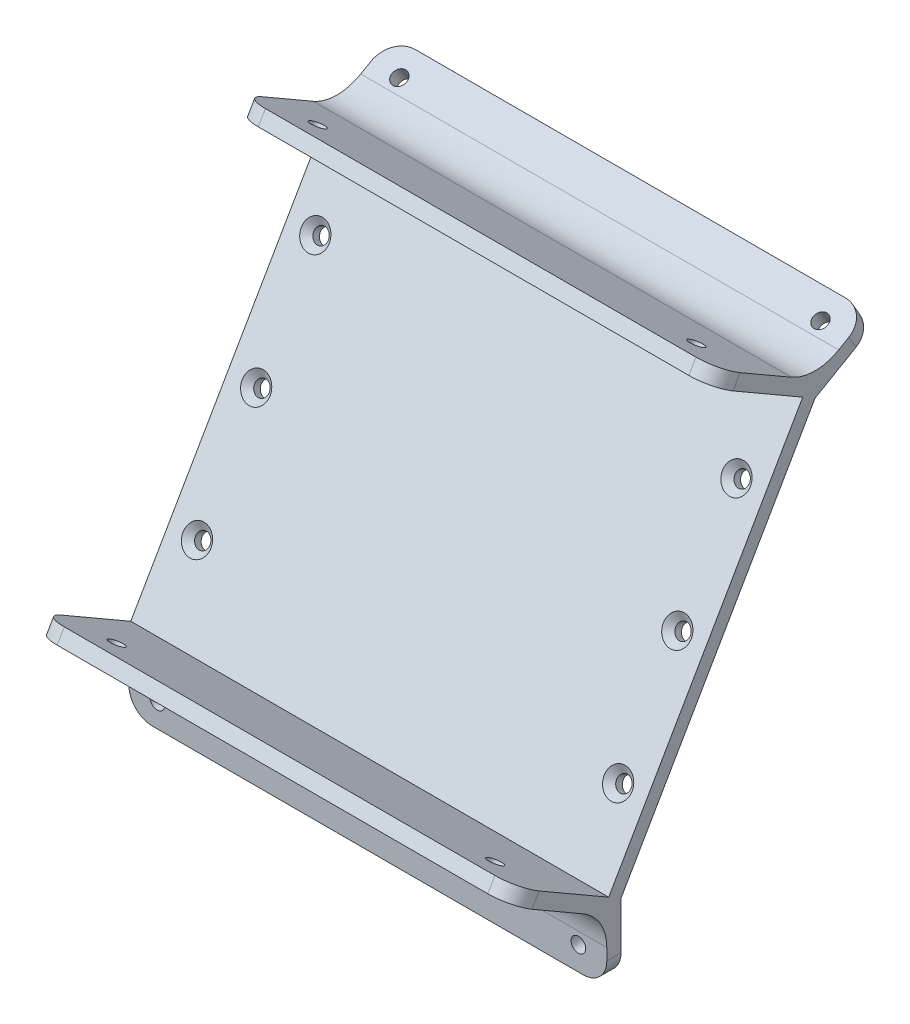
from build123d import *

# Parameters (mm, degrees)
SKETCH_1_W               = 101
SKETCH_1_H               = 15
SKETCH_1_R               = 1.55
EXTRUDE_1_DEPTH          = 3
EXTRUDE_2_DEPTH          = 101
FILLET_1_R               = 10
FILLET_2_R               = 5
SKETCH_3_W               = 101
SKETCH_3_H               = 3
EXTRUDE_3_DEPTH          = 41
SKETCH_4_R               = 1.55
CUT_EXTRUDE_1_DEPTH      = 153.872823645
CUT_EXTRUDE_2_DEPTH      = 149.186409795
CUT_EXTRUDE_2_DEPTH_BACK = 10
SKETCH_5_R               = 1.55
CHAMFER_1_SIZE           = 1.4


with BuildPart() as part:
    # 草图1 → 凸台-拉伸1 (new body)
    with BuildSketch(Plane.XY):
        with Locations((50.5, 7.5)):
            Rectangle(SKETCH_1_W, SKETCH_1_H)
        with Locations((6, 5)):
            Circle(SKETCH_1_R, mode=Mode.SUBTRACT)
        with Locations((95, 5)):
            Circle(SKETCH_1_R, mode=Mode.SUBTRACT)
    extrude(amount=EXTRUDE_1_DEPTH)

    # 草图2 → 凸台-拉伸2 (add)
    with BuildSketch(Plane.ZY):
        Polygon((0, 15), (21.650635095, 27.5), (23.150635095, 24.901923789), (3, 13.267949192), align=None)
    extrude(amount=-EXTRUDE_2_DEPTH)

    # 圆角1
    fillet_1_edges = [part.edges().sort_by_distance(p)[0] for p in [
        (50.5, 13.267949192, 3),
    ]]
    fillet(fillet_1_edges, radius=FILLET_1_R)

    # 圆角2
    fillet_2_edges = [part.edges().sort_by_distance(p)[0] for p in [
        (0, 26.200961894, 22.400635095),
        (101, 26.200961894, 22.400635095),
        (101, 0, 1.5),
        (0, 0, 1.5),
    ]]
    fillet(fillet_2_edges, radius=FILLET_2_R)

    # 草图3 → 凸台-拉伸3 (add)
    with BuildSketch(Plane(origin=(0, 11.25, -6.495190528), x_dir=(1, 0, 0), z_dir=(0, 0.8660254037844364, -0.5000000000000041))):
        with Locations((50.5, -9)):
            Rectangle(SKETCH_3_W, SKETCH_3_H)
    extrude(amount=EXTRUDE_3_DEPTH)

    # 镜向3: part across plane


with BuildPart() as part_1:
    add(part.part)
    add(part.part.mirror(Plane(origin=(0, 46.757041555, -26.995190528), x_dir=(0, 0.500000000000004, 0.8660254037844362), z_dir=(0, 0.8660254037844363, -0.5000000000000041))))

    # 草图4 → 切除-拉伸1 (cut, through all)
    with BuildSketch(Plane(origin=(0, 5.25, 9.09326674), x_dir=(1, 0, 0), z_dir=(0, 0.5000000000000041, 0.8660254037844364))):
        with Locations(Location((6, 78.990381057, 0), (0, 0, 270))):
            Circle(SKETCH_4_R)
        with Locations(Location((6, 53.990381057, 0), (0, 0, 270))):
            Circle(SKETCH_4_R)
        with Locations(Location((6, 28.990381057, 0), (0, 0, 270))):
            Circle(SKETCH_4_R)
        with Locations(Location((95, 78.990381057, 0), (0, 0, 270))):
            Circle(SKETCH_4_R)
        with Locations(Location((95, 53.990381057, 0), (0, 0, 270))):
            Circle(SKETCH_4_R)
        with Locations(Location((95, 28.990381057, 0), (0, 0, 270))):
            Circle(SKETCH_4_R)
    extrude(amount=-CUT_EXTRUDE_1_DEPTH, mode=Mode.SUBTRACT)

    # 草图5 → 切除-拉伸2 (cut, two sides: drawn at the far end of the back side and taken through both)
    with BuildSketch(Plane(origin=(0, 82.26408311, -47.495190528), x_dir=(1, 0, 0), z_dir=(0, -0.8660254037844376, 0.500000000000002)).offset(-CUT_EXTRUDE_2_DEPTH_BACK)):
        with Locations(Location((10, 25.5, 0), (0, 0, 270))):
            Circle(SKETCH_5_R)
        with Locations(Location((90, 25.5, 0), (0, 0, 270))):
            Circle(SKETCH_5_R)
    extrude(amount=CUT_EXTRUDE_2_DEPTH + CUT_EXTRUDE_2_DEPTH_BACK, mode=Mode.SUBTRACT)

    # 倒角1
    chamfer_1_edges = [part_1.edges().sort_by_distance(p)[0] for p in [
        (6, 31.698745836, -6.176923789),
        (6, 53.349380931, -18.676923789),
        (95, 53.349380931, -18.676923789),
        (95, 75.000016026, -31.176923789),
        (95, 31.698745836, -6.176923789),
        (6, 75.000016026, -31.176923789),
    ]]
    chamfer(chamfer_1_edges, length=CHAMFER_1_SIZE)


solid = part_1.part
